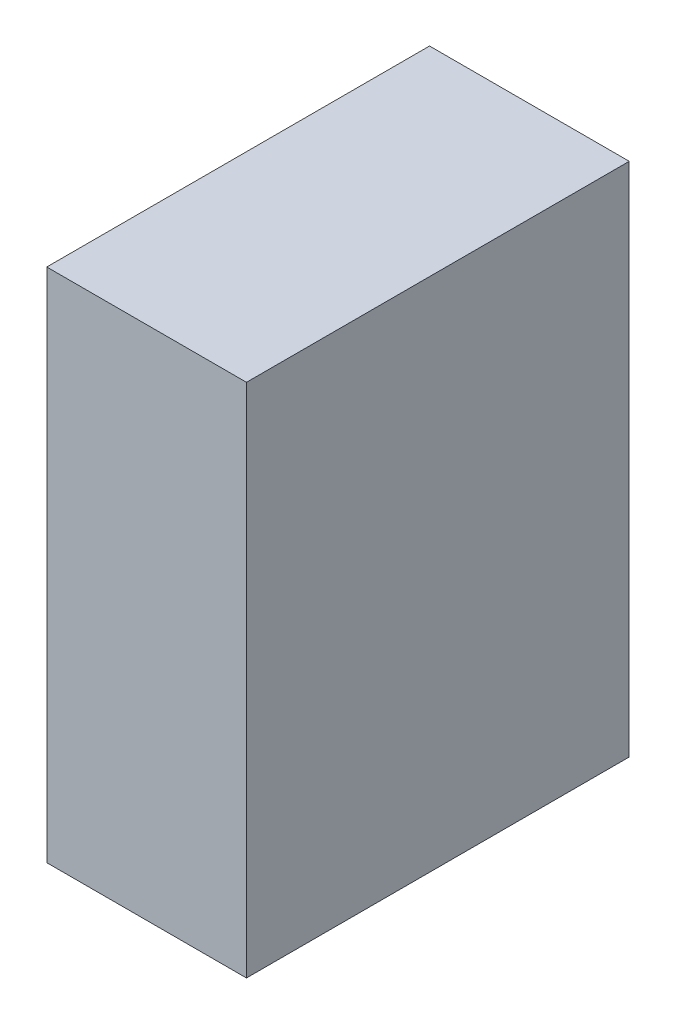
from build123d import *

# Parameters (mm, degrees)
SKETCH1_W           = 146.05
SKETCH1_H           = 196.85
BOSS_EXTRUDE1_DEPTH = 76.2
SKETCH2_R           = 3.175
CUT_EXTRUDE1_DEPTH  = 74.5679992
SKETCH3_R           = 3.96875
CUT_EXTRUDE2_DEPTH  = 50.5679964
SKETCH4_R           = 3.175
CUT_EXTRUDE3_DEPTH  = 38.2679956
SKETCH5_R           = 3.96875
CUT_EXTRUDE4_DEPTH  = 6.2680088
SKETCH6_R           = 4
CUT_EXTRUDE5_DEPTH  = 13.0800094


with BuildPart() as part:
    # Sketch1 → Boss-Extrude1 (new body)
    with BuildSketch(Plane(origin=(0, 0, 0), x_dir=(0, 0, -1), z_dir=(1, 0, 0))):
        with Locations((32.001485149, -25.494306931)):
            Rectangle(SKETCH1_W, SKETCH1_H)
    extrude(amount=BOSS_EXTRUDE1_DEPTH)

    # Sketch2 → Cut-Extrude1 (cut)
    with BuildSketch(Plane.XZ.offset(123.919306931)):
        with Locations(Location((15.96, 29.553514851, 0), (0, 0, 270))):
            Circle(SKETCH2_R)
        with Locations(Location((24.84213013, 29.179530425, 0), (0, 0, 270))):
            Circle(SKETCH2_R)
    extrude(amount=-CUT_EXTRUDE1_DEPTH, mode=Mode.SUBTRACT)

    # Sketch3 → Cut-Extrude2 (cut)
    with BuildSketch(Plane.XZ.offset(123.919306931)):
        with Locations(Location((24.840626577, 29.145383002, 0), (0, 0, 270))):
            Circle(SKETCH3_R)
        with Locations(Location((15.96, 29.553514851, 0), (0, 0, 270))):
            Circle(SKETCH3_R)
    extrude(amount=-CUT_EXTRUDE2_DEPTH, mode=Mode.SUBTRACT)

    # Sketch4 → Cut-Extrude3 (cut)
    with BuildSketch(Plane.XZ.offset(123.919306931)):
        with Locations(Location((30.46, -30.446485149, 0), (0, 0, 270))):
            Circle(SKETCH4_R)
    extrude(amount=-CUT_EXTRUDE3_DEPTH, mode=Mode.SUBTRACT)

    # Sketch5 → Cut-Extrude4 (cut)
    with BuildSketch(Plane.XZ.offset(123.919306931)):
        with Locations(Location((30.46, -30.446485149, 0), (0, 0, 270))):
            Circle(SKETCH5_R)
    extrude(amount=-CUT_EXTRUDE4_DEPTH, mode=Mode.SUBTRACT)

    # Sketch6 → Cut-Extrude5 (cut)
    with BuildSketch(Plane(origin=(0, 0, -105.026485149), x_dir=(-1, 0, 0), z_dir=(0, 0, -1))):
        with Locations(Location((-20.96, -56.151306931, 0), (0, 0, 90))):
            Circle(SKETCH6_R)
        with Locations(Location((-20.96, 13.848693069, 0), (0, 0, 90))):
            Circle(SKETCH6_R)
    extrude(amount=-CUT_EXTRUDE5_DEPTH, mode=Mode.SUBTRACT)


solid = part.part
